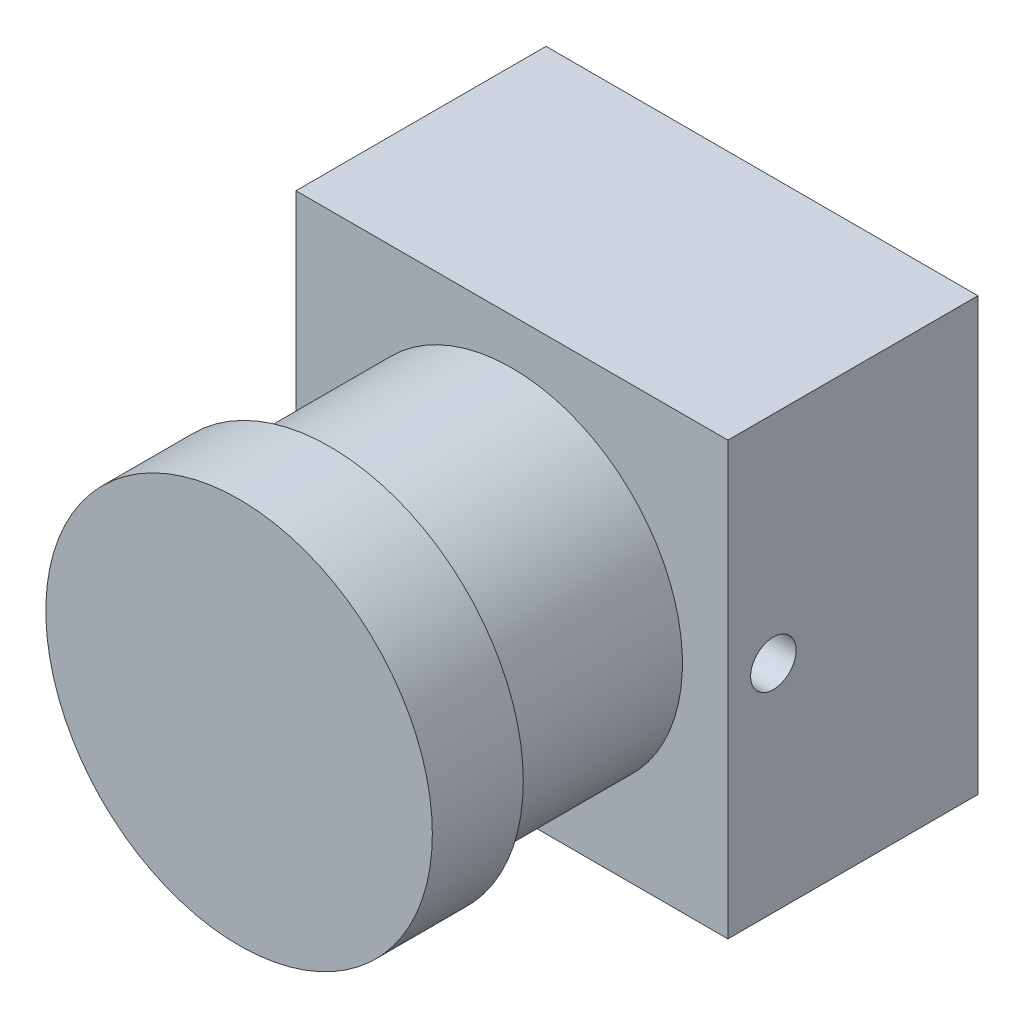
from build123d import *

# Parameters (mm, degrees)
SKETCH1_W           = 19
SKETCH1_H           = 19
BOSS_EXTRUDE1_DEPTH = 11
SKETCH2_R           = 7.5
BOSS_EXTRUDE2_DEPTH = 8
SKETCH4_R           = 8.5
BOSS_EXTRUDE3_DEPTH = 4
SKETCH3_R           = 1
CUT_EXTRUDE1_DEPTH  = 36.369478368


with BuildPart() as part:
    # Sketch1 → Boss-Extrude1 (new body)
    with BuildSketch(Plane.XY):
        with Locations((9.5, 9.5)):
            Rectangle(SKETCH1_W, SKETCH1_H)
    extrude(amount=BOSS_EXTRUDE1_DEPTH)

    # Sketch2 → Boss-Extrude2 (add)
    with BuildSketch(Plane.XY.offset(11)):
        with Locations(Location((9.5, 9.5, 0), (0, 0, 180))):
            Circle(SKETCH2_R)
    extrude(amount=BOSS_EXTRUDE2_DEPTH)

    # Sketch4 → Boss-Extrude3 (add)
    with BuildSketch(Plane.XY.offset(19)):
        with Locations((9.5, 9.5)):
            Circle(SKETCH4_R)
    extrude(amount=BOSS_EXTRUDE3_DEPTH)

    # Sketch3 → Cut-Extrude1 (cut, through all)
    with BuildSketch(Plane(origin=(19, 0, 0), x_dir=(0, 0, -1), z_dir=(1, 0, 0))):
        with Locations((-9, 9.5)):
            Circle(SKETCH3_R)
    extrude(amount=-CUT_EXTRUDE1_DEPTH, mode=Mode.SUBTRACT)


solid = part.part
